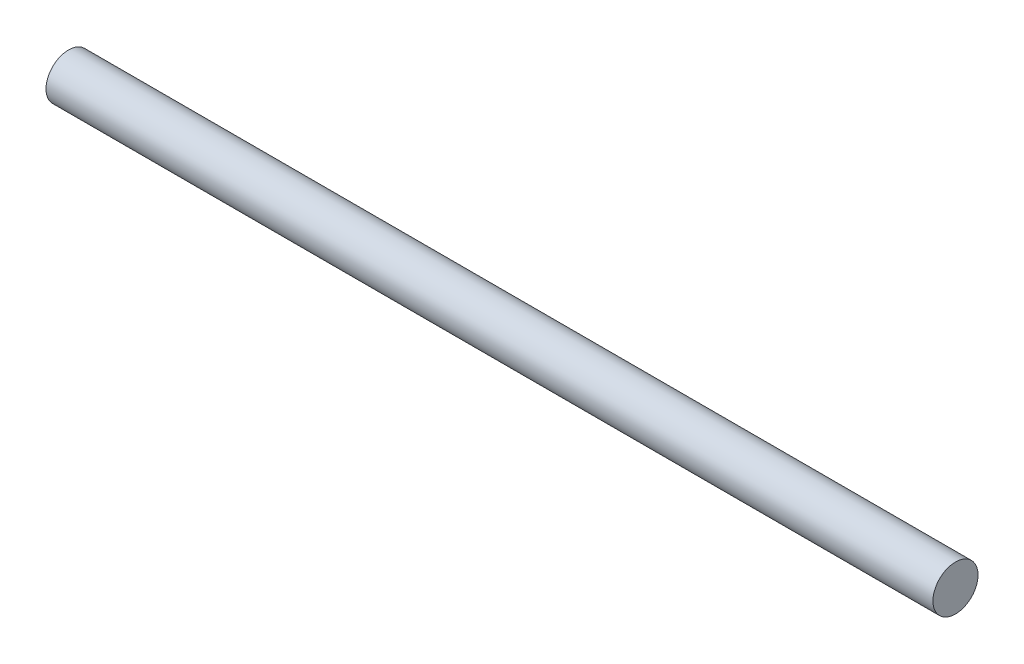
from build123d import *

# Parameters (mm, degrees)
CROQUIS1_R              = 4.7625
SALIENTE_EXTRUIR1_DEPTH = 187.24


with BuildPart() as part:
    # Croquis1 → Saliente-Extruir1 (new body)
    with BuildSketch(Plane(origin=(0, 0, 0), x_dir=(0, 0, -1), z_dir=(1, 0, 0))):
        with Locations(Location((0, 0, 0), (0, 0, 180))):
            Circle(CROQUIS1_R)
    extrude(amount=SALIENTE_EXTRUIR1_DEPTH)


solid = part.part
